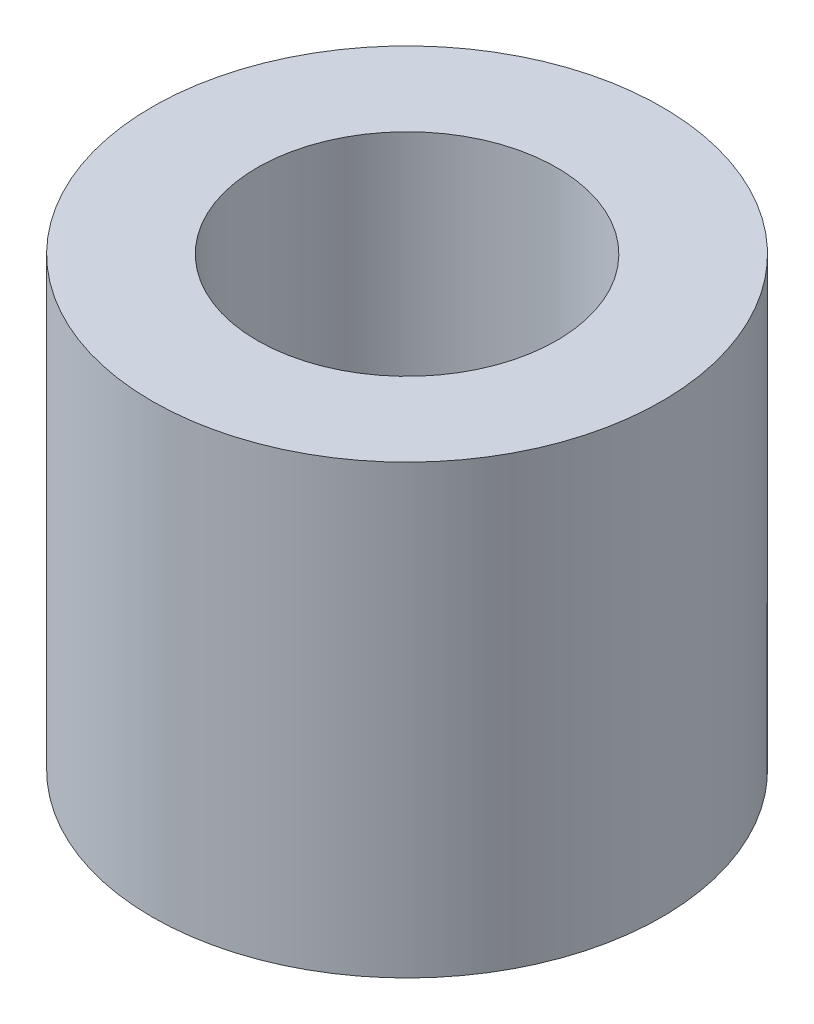
from build123d import *

# Parameters (mm, degrees)
SKETCH1_R           = 2.425
SKETCH1_R_2         = 1.425
BOSS_EXTRUDE1_DEPTH = 4.25


with BuildPart() as part:
    # Sketch1 → Boss-Extrude1 (new body)
    with BuildSketch(Plane(origin=(0, 0, 0), x_dir=(1, 0, 0), z_dir=(0, 1, 0))):
        with Locations(Location((0, 0, 0), (0, 0, 270))):
            Circle(SKETCH1_R)
        with Locations(Location((0, 0, 0), (0, 0, 270))):
            Circle(SKETCH1_R_2, mode=Mode.SUBTRACT)
    extrude(amount=BOSS_EXTRUDE1_DEPTH)


solid = part.part
